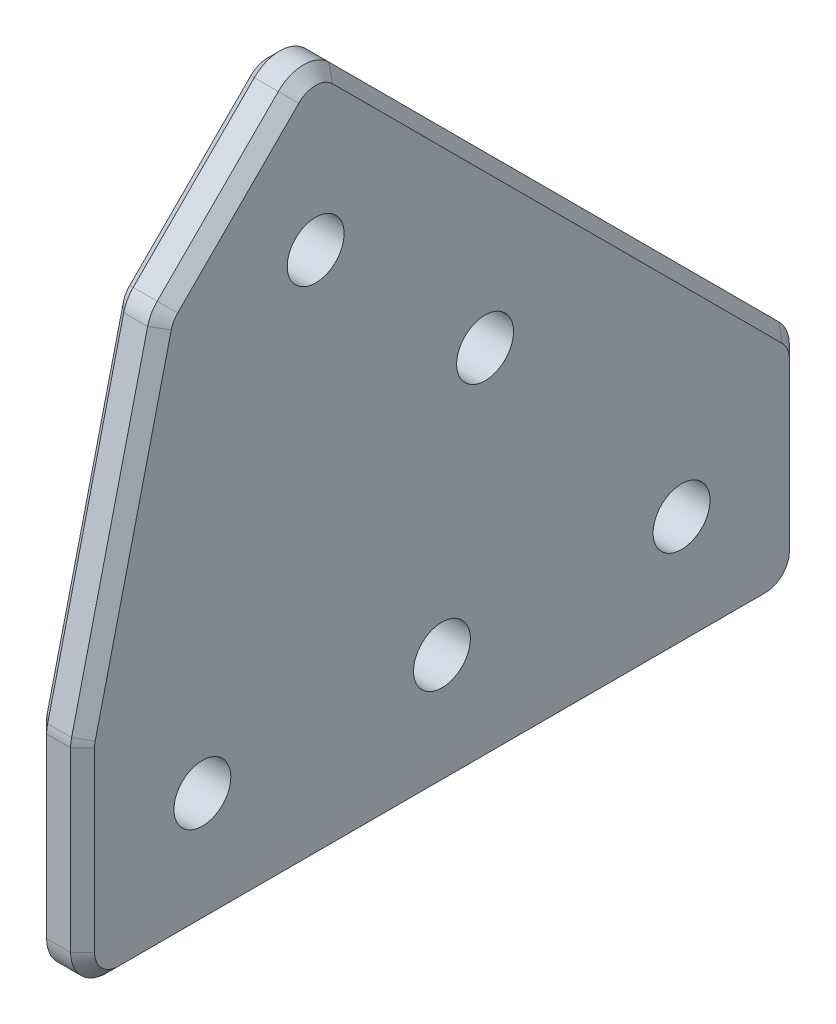
from build123d import *

# Parameters (mm, degrees)
BOSS_EXTRUDE1_DEPTH      = 4
SKETCH2_R                = 2.375
CUT_EXTRUDE1_DEPTH       = 98.803788642
LPATTERN1_COUNT          = 3
LPATTERN1_PITCH          = 20
SKETCH2_4_R              = 2.375
CUT_EXTRUDE2_DEPTH       = 98.803788642
LPATTERN2_COUNT          = 2
LPATTERN2_PITCH          = 20
FILLET1_R                = 3
CHANFRO1_SIZE            = 1
RESSALTO_EXTRUS_O1_START = -4
ESBO_O1_W                = 10
ESBO_O1_H                = 6
RESSALTO_EXTRUS_O1_DEPTH = 2


with BuildPart() as part:
    # Sketch1 → Boss-Extrude1 (new body)
    with BuildSketch(Plane(origin=(0, 0, 0), x_dir=(0, 0, -1), z_dir=(1, 0, 0))):
        Polygon((-78.140120378, 0), (-18.140120378, 0), (-18.140120378, 18.140120378), (-58.68306962, 58.68306962), (-71.510071751, 45.856067489), (-78.140120378, 18.140120378), align=None)
    extrude(amount=BOSS_EXTRUDE1_DEPTH)

    # Sketch2 → Cut-Extrude1 (cut, through all)
    with BuildSketch(Plane(origin=(4, 0, 0), x_dir=(0, 0, -1), z_dir=(1, 0, 0))):
        with Locations((-28.140120378, 10)):
            Circle(SKETCH2_R)
    cut_extrude1 = extrude(amount=-CUT_EXTRUDE1_DEPTH, mode=Mode.SUBTRACT)

    # LPattern1: Cut-Extrude1 ×3
    with Locations(*[(0, 0, i * LPATTERN1_PITCH) for i in range(1, LPATTERN1_COUNT)]):
        add(cut_extrude1, mode=Mode.SUBTRACT)

    # Sketch2<4> → Cut-Extrude2 (cut, through all)
    with BuildSketch(Plane(origin=(4, 0, 0), x_dir=(0, 0, -1), z_dir=(1, 0, 0))):
        with Locations((-58.68306962, 44.540933996)):
            Circle(SKETCH2_4_R)
    cut_extrude2 = extrude(amount=-CUT_EXTRUDE2_DEPTH, mode=Mode.SUBTRACT)

    # LPattern2: Cut-Extrude2 ×2
    with Locations(*[Vector(0, -0.7071067811865476, -0.7071067811865476) * (i * LPATTERN2_PITCH) for i in range(1, LPATTERN2_COUNT)]):
        add(cut_extrude2, mode=Mode.SUBTRACT)

    # Fillet1
    fillet1_edges = [part.edges().sort_by_distance(p)[0] for p in [
        (2, 18.140120378, 78.140120378),
        (2, 45.856067489, 71.510071751),
        (2, 58.68306962, 58.68306962),
        (2, 18.140120378, 18.140120378),
        (2, 0, 18.140120378),
        (2, 0, 78.140120378),
    ]]
    fillet(fillet1_edges, radius=FILLET1_R)

    # Chanfro1
    chanfro1_edges = [part.edges().sort_by_distance(p)[0] for p in [
        (0, 0, 48.140120378),
        (4, 0, 48.140120378),
        (0, 10.393145239, 78.140120378),
        (0, 31.75807492, 74.882512025),
        (0, 51.508513622, 65.857625619),
        (0, 37.790274655, 37.790274655),
        (0, 9.948739845, 18.140120378),
        (0, 57.440428933, 58.68306962),
        (0, 18.045529988, 18.36848178),
        (0, 0.878679656, 19.018800034),
        (0, 45.798751214, 71.407627967),
        (0, 18.137684762, 78.119469645),
        (0, 0.878679656, 77.261440721),
        (4, 10.393145239, 78.140120378),
        (4, 9.948739845, 18.140120378),
        (4, 37.790274655, 37.790274655),
        (4, 51.508513622, 65.857625619),
        (4, 31.75807492, 74.882512025),
        (4, 57.440428933, 58.68306962),
        (4, 18.045529988, 18.36848178),
        (4, 0.878679656, 19.018800034),
        (4, 45.798751214, 71.407627967),
        (4, 18.137684762, 78.119469645),
        (4, 0.878679656, 77.261440721),
    ]]
    chamfer(chanfro1_edges, length=CHANFRO1_SIZE)

    # Esboço1 → Ressalto-extrusão1 (add)
    with BuildSketch(Plane(origin=(4, 0, 0), x_dir=(0, 0, -1), z_dir=(1, 0, 0)).offset(RESSALTO_EXTRUS_O1_START)):
        Polygon((-57.21666665, 39.183379746), (-50.59244791, 31.692069708), (-46.097661887, 35.666600952), (-52.721880627, 43.15791099), align=None)
        with Locations((-58.140120378, 10)):
            Rectangle(ESBO_O1_W, ESBO_O1_H)
        with Locations((-38.140120378, 10)):
            Rectangle(ESBO_O1_W, ESBO_O1_H)
    extrude(amount=-RESSALTO_EXTRUS_O1_DEPTH)


solid = part.part
